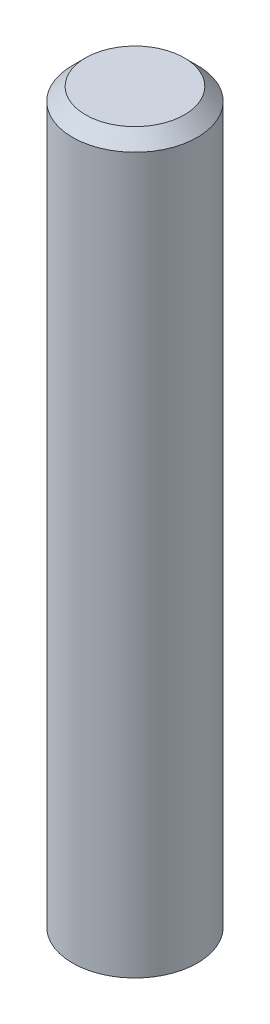
from build123d import *

# Parameters (mm, degrees)
SKETCH_1_R      = 2.4
EXTRUDE_1_DEPTH = 28
CHAMFER_1_SIZE  = 0.5
M3X0_51_D       = 2.5
M3X0_51_DEPTH   = 3
M3X0_51_TIP     = 0.751075774


with BuildPart() as part:
    # Эскиз1 → Бобышка-Вытянуть1 (new body)
    with BuildSketch(Plane(origin=(0, 0, 0), x_dir=(1, 0, 0), z_dir=(0, 1, 0))):
        with Locations(Location((0, 0, 0), (0, 0, 270))):
            Circle(SKETCH_1_R)
    extrude(amount=EXTRUDE_1_DEPTH)

    # Фаска1
    chamfer_1_edges = [part.edges().sort_by_distance(p)[0] for p in [
        (0, 28, -2.4),
    ]]
    chamfer(chamfer_1_edges, length=CHAMFER_1_SIZE)

    # Отверстие обработанное метчиком M3x0.51
    with Locations(Plane(origin=(0, 0, -2.4), x_dir=(-1, 0, 0), z_dir=(0, 0, -1))):
        with Locations((0, 9)):
            Hole(M3X0_51_D / 2, depth=M3X0_51_DEPTH)
            with Locations((0, 0, -(M3X0_51_DEPTH + M3X0_51_TIP / 2))):  # 118° drill point
                Cone(0, M3X0_51_D / 2, M3X0_51_TIP, mode=Mode.SUBTRACT)


solid = part.part
